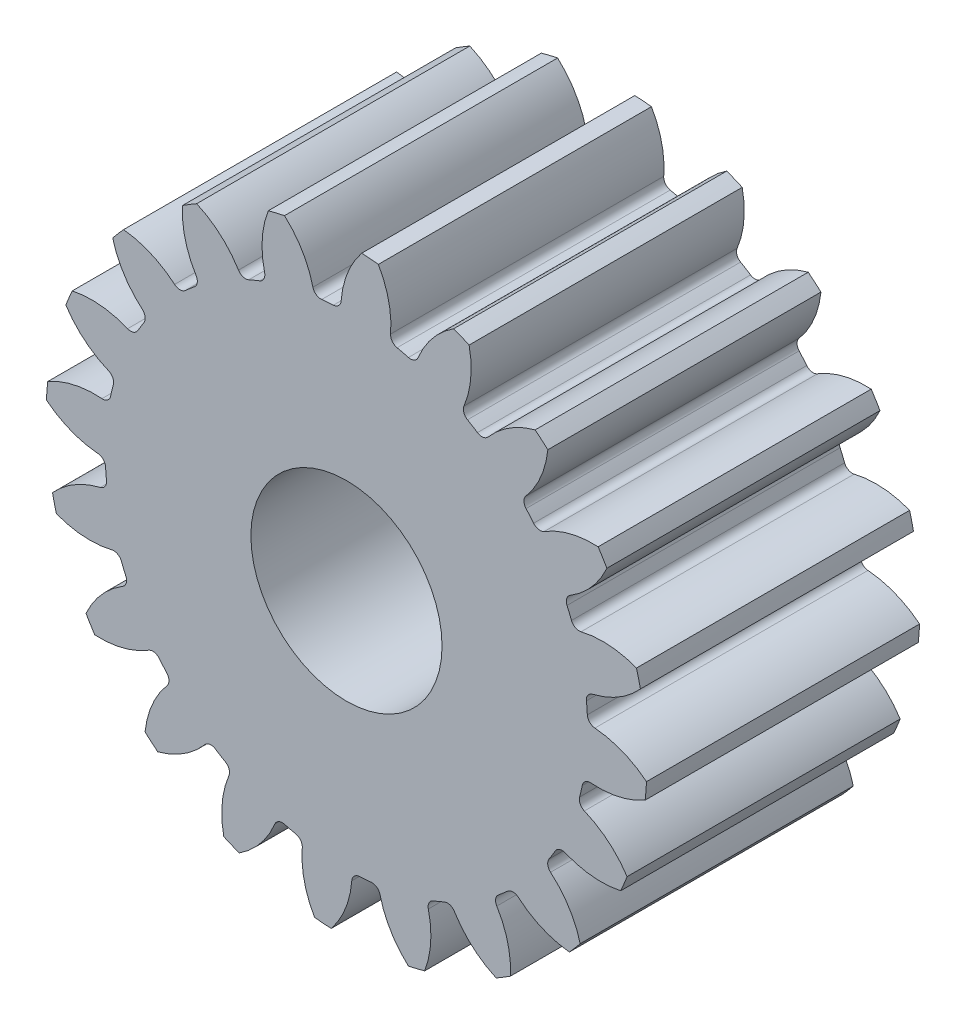
from build123d import *

# Parameters (mm, degrees)
CROQUIS1_R              = 3.5
SALIENTE_EXTRUIR1_DEPTH = 10
REDONDEO1_R             = 0.3
MATRIZC1_COUNT          = 20
REDONDEO1_OF_MATRIZC1_R = 0.3


with BuildPart() as part:
    # Croquis1 → Saliente-Extruir1 (new body)
    with BuildSketch(Plane.XY):
        with BuildLine():
            ThreePointArc((-0.206276665, 8.830591087), (-0.69374382, -8.805714537), (1.586556233, 8.689345678))
            ThreePointArc((1.586556233, 8.689345678), (1.571102546, 9.84950373), (1.168679636, 10.937741445))
            ThreePointArc((1.168679636, 10.937741445), (0.86394, 10.966020594), (0.558531589, 10.985810961))
            ThreePointArc((0.558531589, 10.985810961), (-0.009338943, 9.974016228), (-0.206276665, 8.830591087))
        make_face()
        Circle(CROQUIS1_R, mode=Mode.SUBTRACT)
    saliente_extruir1 = extrude(amount=SALIENTE_EXTRUIR1_DEPTH)

    # Redondeo1
    redondeo1_edges = [part.edges().sort_by_distance(p)[0] for p in [
        (1.586556233, 8.689345678, 5),
        (-0.206276665, 8.830591087, 5),
    ]]
    fillet(redondeo1_edges, radius=REDONDEO1_R)

    # MatrizC1: Saliente-Extruir1 ×20 about axis
    matrizc1_axis = Axis((0, 0, 0), (0, 0, 1))
    for i in range(1, MATRIZC1_COUNT):
        add(saliente_extruir1.rotate(matrizc1_axis, i * 360 / MATRIZC1_COUNT))

    # Redondeo1 of MatrizC1
    redondeo1_of_matrizc1_edges = [part.edges().sort_by_distance(p)[0] for p in [
        (-1.17625084, 8.754331668, 5),
        (-2.924983483, 8.3346482, 5),
        (-3.823918286, 7.96238268, 5),
        (-5.357372538, 7.022851878, 5),
        (-6.097273968, 6.391020197, 5),
        (-7.265344641, 5.023609882, 5),
        (-7.773785991, 4.194060129, 5),
        (-8.462134191, 2.532621949, 5),
        (-8.689345678, 1.586556233, 5),
        (-8.830591087, -0.206276665, 5),
        (-8.754331668, -1.17625084, 5),
        (-8.3346482, -2.924983483, 5),
        (-7.96238268, -3.823918286, 5),
        (-7.022851878, -5.357372538, 5),
        (-6.391020197, -6.097273968, 5),
        (-5.023609882, -7.265344641, 5),
        (-4.194060129, -7.773785991, 5),
        (-2.532621949, -8.462134191, 5),
        (-1.586556233, -8.689345678, 5),
        (0.206276665, -8.830591087, 5),
        (1.17625084, -8.754331668, 5),
        (2.924983483, -8.3346482, 5),
        (3.823918286, -7.96238268, 5),
        (5.357372538, -7.022851878, 5),
        (6.097273968, -6.391020197, 5),
        (7.265344641, -5.023609882, 5),
        (7.773785991, -4.194060129, 5),
        (8.462134191, -2.532621949, 5),
        (8.689345678, -1.586556233, 5),
        (8.830591087, 0.206276665, 5),
        (8.754331668, 1.17625084, 5),
        (8.3346482, 2.924983483, 5),
        (7.96238268, 3.823918286, 5),
        (7.022851878, 5.357372538, 5),
        (6.391020197, 6.097273968, 5),
        (5.023609882, 7.265344641, 5),
        (4.194060129, 7.773785991, 5),
        (2.532621949, 8.462134191, 5),
    ]]
    fillet(redondeo1_of_matrizc1_edges, radius=REDONDEO1_OF_MATRIZC1_R)


solid = part.part
